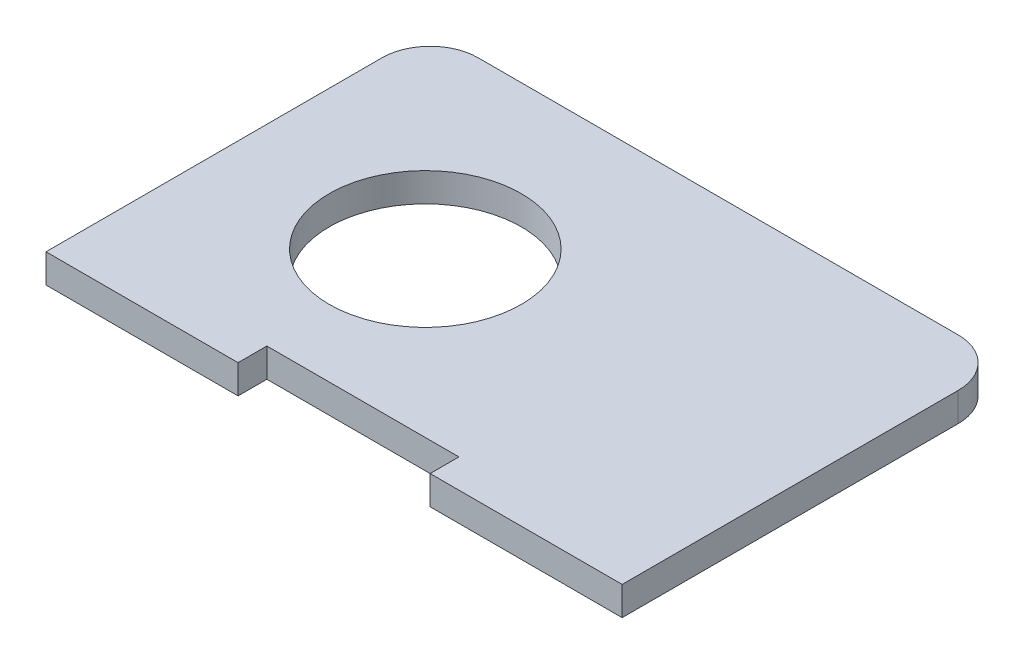
from build123d import *

# Parameters (mm, degrees)
SKETCH1_R           = 10
BOSS_EXTRUDE1_DEPTH = 3
FILLET1_R           = 5


with BuildPart() as part:
    # Sketch1 → Boss-Extrude1 (new body)
    with BuildSketch(Plane(origin=(0, 0, 0), x_dir=(1, 0, 0), z_dir=(0, 1, 0))):
        Polygon((10, -20), (30, -20), (30, 20), (-30, 20), (-30, -20), (-10, -20), (-10, -17), (10, -17), align=None)
        with Locations(Location((-10.5, 0, 0), (0, 0, 270))):
            Circle(SKETCH1_R, mode=Mode.SUBTRACT)
    extrude(amount=BOSS_EXTRUDE1_DEPTH)

    # Fillet1
    fillet1_edges = [part.edges().sort_by_distance(p)[0] for p in [
        (-30, 1.5, -20),
        (30, 1.5, -20),
    ]]
    fillet(fillet1_edges, radius=FILLET1_R)


solid = part.part
